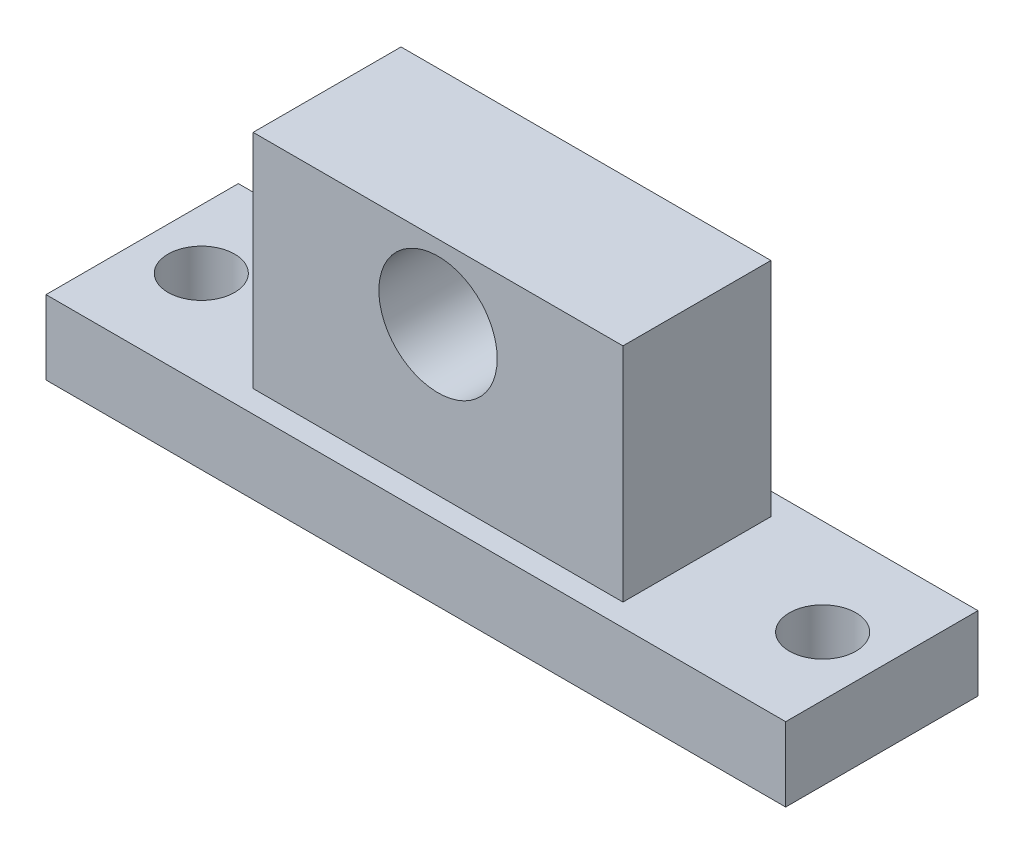
from build123d import *

# Parameters (mm, degrees)
SKETCH1_W           = 50
SKETCH1_H           = 13
BOSS_EXTRUDE1_DEPTH = 5
SKETCH2_R           = 2.25
CUT_EXTRUDE1_DEPTH  = 5
SKETCH3_W           = 25
SKETCH3_H           = 10
BOSS_EXTRUDE2_DEPTH = 15
SKETCH4_R           = 4
CUT_EXTRUDE2_DEPTH  = 15


with BuildPart() as part:
    # Sketch1 → Boss-Extrude1 (new body)
    with BuildSketch(Plane(origin=(0, 0, 0), x_dir=(1, 0, 0), z_dir=(0, 1, 0))):
        Rectangle(SKETCH1_W, SKETCH1_H)
    extrude(amount=BOSS_EXTRUDE1_DEPTH)

    # Sketch2 → Cut-Extrude1 (cut)
    with BuildSketch(Plane(origin=(0, 5, 0), x_dir=(1, 0, 0), z_dir=(0, 1, 0))):
        with Locations(Location((-21, 0, 0), (0, 0, 270))):
            Circle(SKETCH2_R)
        with Locations(Location((21, 0, 0), (0, 0, 270))):
            Circle(SKETCH2_R)
    extrude(amount=-CUT_EXTRUDE1_DEPTH, mode=Mode.SUBTRACT)

    # Sketch3 → Boss-Extrude2 (add)
    with BuildSketch(Plane(origin=(0, 5, 0), x_dir=(1, 0, 0), z_dir=(0, 1, 0))):
        Rectangle(SKETCH3_W, SKETCH3_H)
    extrude(amount=BOSS_EXTRUDE2_DEPTH)

    # Sketch4 → Cut-Extrude2 (cut)
    with BuildSketch(Plane.XY.offset(5)):
        with Locations((0, 15)):
            Circle(SKETCH4_R)
    extrude(amount=-CUT_EXTRUDE2_DEPTH, mode=Mode.SUBTRACT)


solid = part.part
